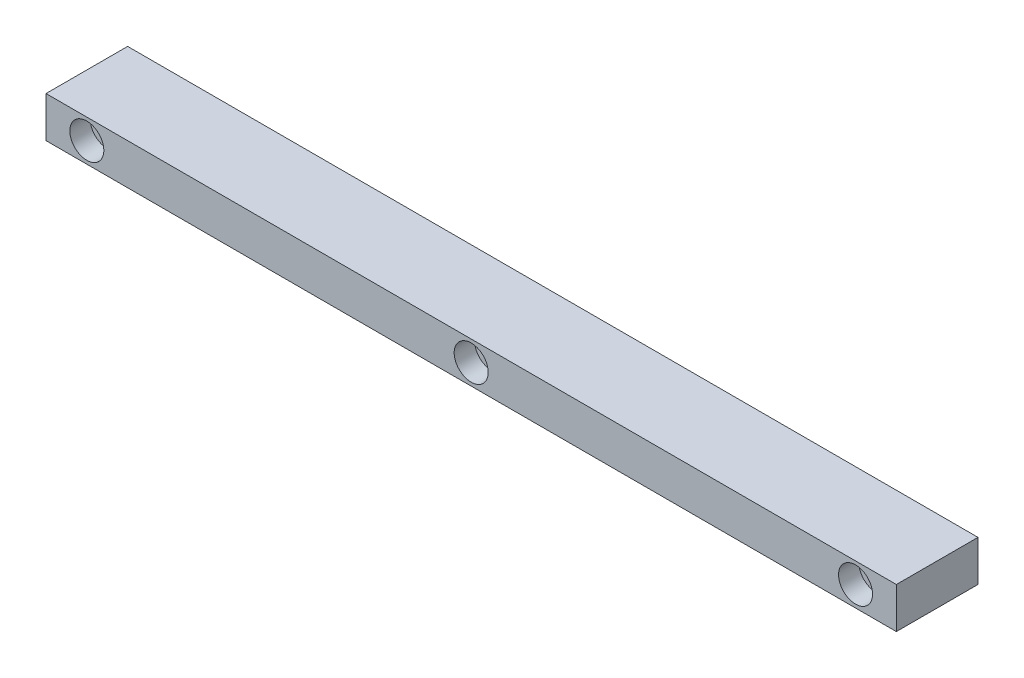
from build123d import *

# Parameters (mm, degrees)
ESQUISSE1_W             = 500
ESQUISSE1_H             = 24
BOSS_EXTRU_1_DEPTH      = 48
ESQUISSE2_R             = 4
ENL_V_MAT_EXTRU_1_DEPTH = 255.848974885
ESQUISSE3_R             = 10
ENL_V_MAT_EXTRU_2_DEPTH = 12
ESQUISSE4_R             = 7
ENL_V_MAT_EXTRU_3_DEPTH = 12


with BuildPart() as part:
    # Esquisse1 → Boss.-Extru.1 (new body)
    with BuildSketch(Plane.XY):
        Rectangle(ESQUISSE1_W, ESQUISSE1_H)
    extrude(amount=BOSS_EXTRU_1_DEPTH)

    # Esquisse2 → Enlèv. mat.-Extru.1 (cut, through all)
    with BuildSketch(Plane.XY.offset(48)):
        with Locations((-226, 0)):
            Circle(ESQUISSE2_R)
        Circle(ESQUISSE2_R)
        with Locations((226, 0)):
            Circle(ESQUISSE2_R)
    extrude(amount=-ENL_V_MAT_EXTRU_1_DEPTH, mode=Mode.SUBTRACT)

    # Esquisse3 → Enlèv. mat.-Extru.2 (cut)
    with BuildSketch(Plane.XY.offset(48)):
        with Locations((-226, 0)):
            Circle(ESQUISSE3_R)
        Circle(ESQUISSE3_R)
        with Locations((226, 0)):
            Circle(ESQUISSE3_R)
    extrude(amount=-ENL_V_MAT_EXTRU_2_DEPTH, mode=Mode.SUBTRACT)

    # Esquisse4 → Enlèv. mat.-Extru.3 (cut)
    with BuildSketch(Plane(origin=(0, 0, 0), x_dir=(-1, 0, 0), z_dir=(0, 0, -1))):
        with Locations((-226, 0)):
            Circle(ESQUISSE4_R)
        Circle(ESQUISSE4_R)
        with Locations((226, 0)):
            Circle(ESQUISSE4_R)
    extrude(amount=-ENL_V_MAT_EXTRU_3_DEPTH, mode=Mode.SUBTRACT)


solid = part.part
